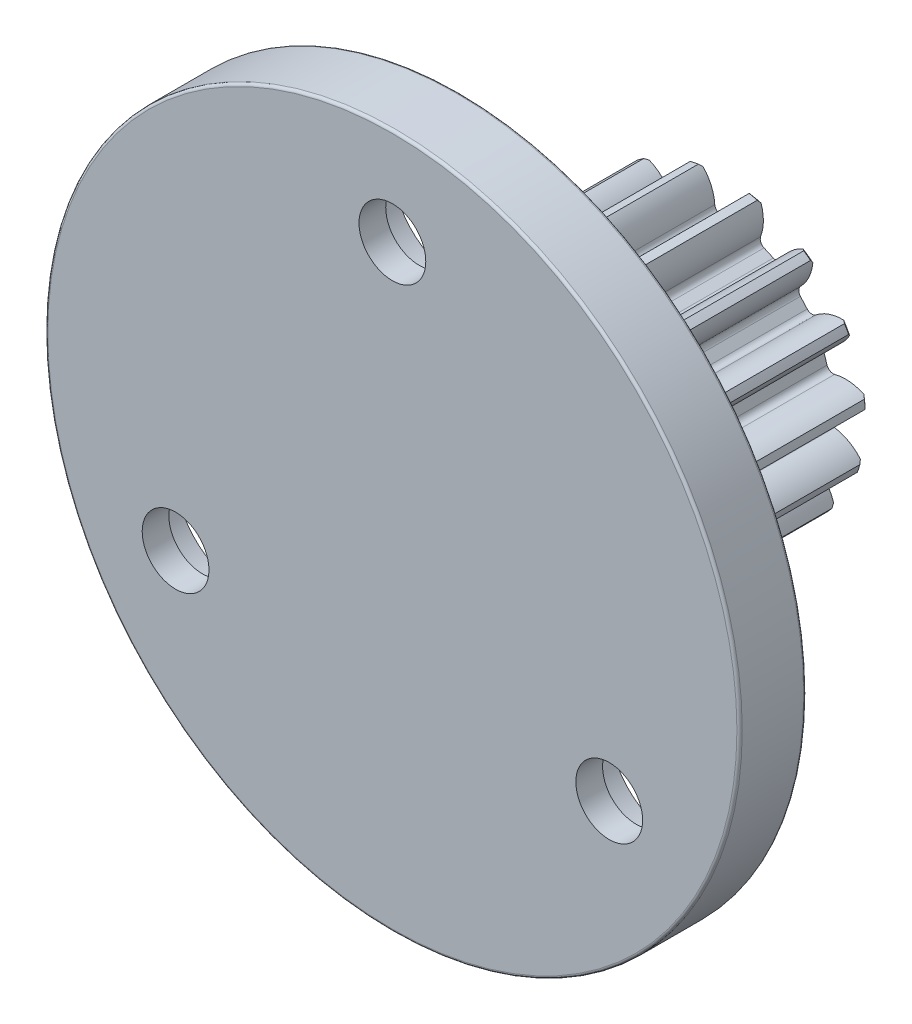
from build123d import *
from OCP.BRepFilletAPI import BRepFilletAPI_MakeChamfer

# Parameters (mm, degrees)
BOSS_EXTRUDE1_DEPTH      = 10
BOSS_EXTRUDE1_DEPTH_BACK = 10.0001
SKETCH2_R                = 10.625
M6_TAPPED_HOLE1_D        = 5.5
CHAMFER2_SIZE            = 0.2
CHAMFER2_SIZE2           = 0.186503017
CIRPATTERN1_COUNT        = 15
SKETCH9_R                = 26
BOSS_EXTRUDE2_DEPTH      = 5
M5_CLEARANCE_HOLE1_D     = 5
CIRPATTERN2_COUNT        = 3
FILLET1_R                = 0.2
SKETCH15_R               = 5
CUT_EXTRUDE1_DEPTH       = 3
SKETCH16_R               = 5
CUT_EXTRUDE2_DEPTH       = 3


with BuildPart() as part:
    # Sketch2 → Boss-Extrude1 (new, two sides: drawn at the far end of the back side and taken through both)
    with BuildSketch(Plane.XY.offset(-BOSS_EXTRUDE1_DEPTH_BACK)):
        Circle(SKETCH2_R)
    extrude(amount=BOSS_EXTRUDE1_DEPTH + BOSS_EXTRUDE1_DEPTH_BACK)

    # M6 Tapped Hole1 (through all)
    with Locations(Plane.XY.offset(10)):
        with Locations((0, 0)):
            Hole(M6_TAPPED_HOLE1_D / 2)

    # Chamfer2: one chamfer whose edges measure the first distance from different faces: ONE call of the kernel's chamfer builder (chamfer() names one face for all edges)
    chamfer2_edges_1 = [part.edges().sort_by_distance(p)[0] for p in [
        (2.75, 0, 10),
    ]]
    chamfer2_side_1 = [part.faces().sort_by_distance(p)[0] for p in [
        (-10.324479618, 0, 10),
    ]]
    chamfer2_edges_2 = [part.edges().sort_by_distance(p)[0] for p in [
        (2.75, 0, -10.0001),
    ]]
    chamfer2_side_2 = [part.faces().sort_by_distance(p)[0] for p in [
        (2.75, 0, -5e-05),
    ]]
    chamfer2_edges_3 = [part.edges().sort_by_distance(p)[0] for p in [
        (-10.625, 0, 10),
    ]]
    chamfer2_side_3 = [part.faces().sort_by_distance(p)[0] for p in [
        (-10.625, 0, 5),
    ]]
    chamfer2_edges_4 = [part.edges().sort_by_distance(p)[0] for p in [
        (-10.625, 0, -10.0001),
    ]]
    chamfer2_side_4 = [part.faces().sort_by_distance(p)[0] for p in [
        (-10.324479618, 0, -10.0001),
    ]]
    chamfer2 = BRepFilletAPI_MakeChamfer(part.part.solid().wrapped)
    for e in chamfer2_edges_1:
        chamfer2.Add(CHAMFER2_SIZE, CHAMFER2_SIZE2, e.wrapped, chamfer2_side_1[0].wrapped)  # the first distance lies on this face
    for e in chamfer2_edges_2:
        chamfer2.Add(CHAMFER2_SIZE, CHAMFER2_SIZE2, e.wrapped, chamfer2_side_2[0].wrapped)  # the first distance lies on this face
    for e in chamfer2_edges_3:
        chamfer2.Add(CHAMFER2_SIZE, CHAMFER2_SIZE2, e.wrapped, chamfer2_side_3[0].wrapped)  # the first distance lies on this face
    for e in chamfer2_edges_4:
        chamfer2.Add(CHAMFER2_SIZE, CHAMFER2_SIZE2, e.wrapped, chamfer2_side_4[0].wrapped)  # the first distance lies on this face
    add(Compound.cast(chamfer2.Shape()), mode=Mode.REPLACE)

    # Cut-Sweep1: sweep along a curve in space
    with BuildLine() as cut_sweep1_path:
        Line((0, 10.625, 10), (0, 10.625, -10.0001))
    # Sketch8 → Cut-Sweep1 (sweep, cut)
    with BuildSketch(Plane.XY.offset(10)):
        with BuildLine():
            Line((-0.38, 7.815), (0.38, 7.815))
            ThreePointArc((0.38, 7.815), (0.704494944, 7.941300931), (0.858223165, 8.25373737))
            ThreePointArc((0.858223165, 8.25373737), (1.165364191, 9.454954225), (1.9, 10.45373737))
            ThreePointArc((1.9, 10.45373737), (0, 10.625), (-1.9, 10.45373737))
            ThreePointArc((-1.9, 10.45373737), (-1.165364191, 9.454954225), (-0.858223165, 8.25373737))
            ThreePointArc((-0.858223165, 8.25373737), (-0.704494944, 7.941300931), (-0.38, 7.815))
        make_face()
    cut_sweep1 = sweep(path=cut_sweep1_path.line, mode=Mode.SUBTRACT)

    # CirPattern1: Cut-Sweep1 ×15 about axis
    cirpattern1_axis = Axis((0, 0, 0), (0, 0, 1))
    for i in range(1, CIRPATTERN1_COUNT):
        add(cut_sweep1.rotate(cirpattern1_axis, i * 360 / CIRPATTERN1_COUNT), mode=Mode.SUBTRACT)

    # Sketch9 → Boss-Extrude2 (add)
    with BuildSketch(Plane.XY.offset(10)):
        Circle(SKETCH9_R)
    extrude(amount=BOSS_EXTRUDE2_DEPTH)

    # M5 Clearance Hole1 (through all)
    with Locations(Plane(origin=(0, 0, 10), x_dir=(-1, 0, 0), z_dir=(0, 0, -1))):
        with Locations((0, 18.75)):
            m5_clearance_hole1 = Hole(M5_CLEARANCE_HOLE1_D / 2)

    # CirPattern2: M5 Clearance Hole1 ×3 about axis
    cirpattern2_axis = Axis((0, 0, 0), (0, 0, 1))
    for i in range(1, CIRPATTERN2_COUNT):
        add(m5_clearance_hole1.rotate(cirpattern2_axis, i * 360 / CIRPATTERN2_COUNT), mode=Mode.SUBTRACT)

    # Fillet1
    fillet1_edges = [part.edges().sort_by_distance(p)[0] for p in [
        (-26, 0, 10),
        (-26, 0, 15),
    ]]
    fillet(fillet1_edges, radius=FILLET1_R)

    # Sketch15 → Cut-Extrude1 (cut)
    with BuildSketch(Plane(origin=(0, 0, 10), x_dir=(-1, 0, 0), z_dir=(0, 0, -1))):
        with Locations((-16.237976321, -9.375)):
            Circle(SKETCH15_R)
    extrude(amount=-CUT_EXTRUDE1_DEPTH, mode=Mode.SUBTRACT)

    # Sketch16 → Cut-Extrude2 (cut)
    with BuildSketch(Plane(origin=(0, 0, 10), x_dir=(-1, 0, 0), z_dir=(0, 0, -1))):
        with Locations((0, 18.75)):
            Circle(SKETCH16_R)
        with Locations((16.237976321, -9.375)):
            Circle(SKETCH16_R)
    extrude(amount=-CUT_EXTRUDE2_DEPTH, mode=Mode.SUBTRACT)


solid = part.part
